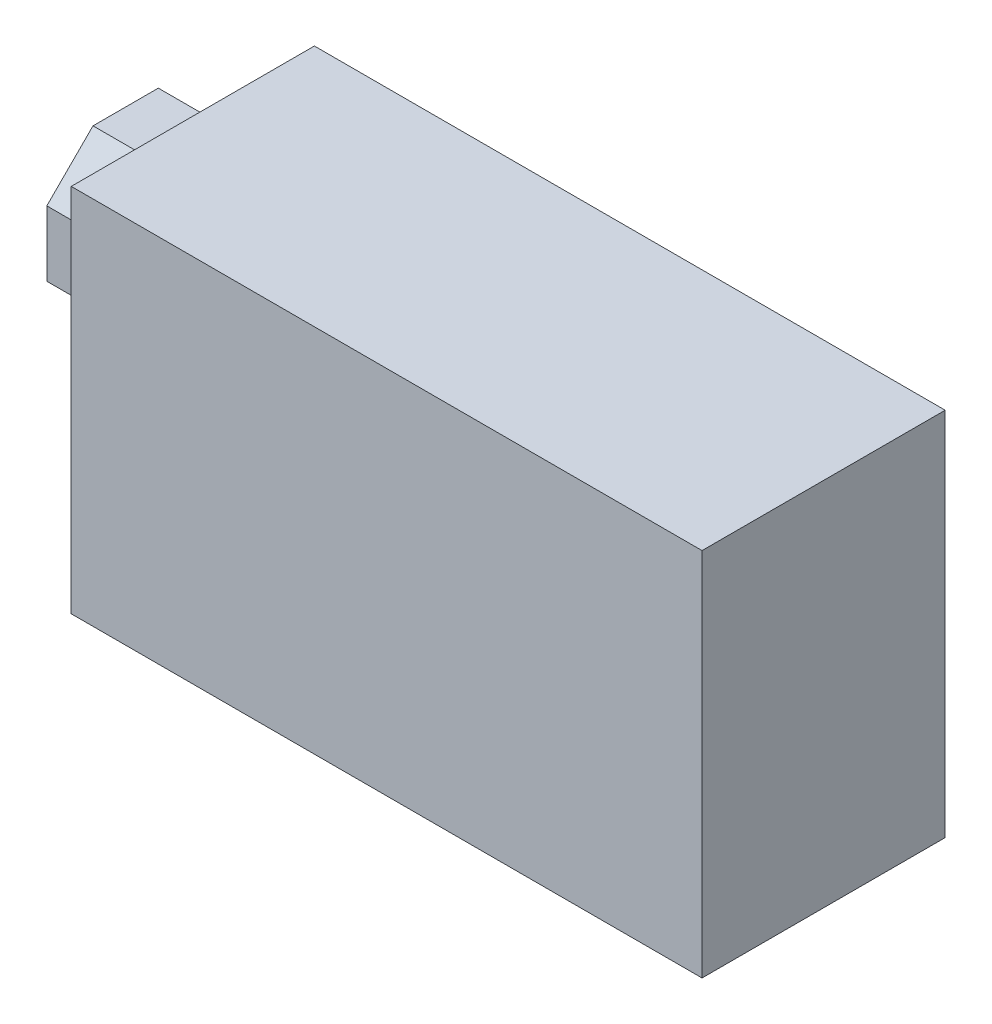
from build123d import *

# Parameters (mm, degrees)
SKETCH1_W           = 44.15
SKETCH1_H           = 25.908
BOSS_EXTRUDE1_DEPTH = 17.018
SKETCH2_R           = 3.556
BOSS_EXTRUDE2_DEPTH = 4.7
SKETCH3_R           = 2.438606829
CUT_EXTRUDE1_DEPTH  = 3.81


with BuildPart() as part:
    # Sketch1 → Boss-Extrude1 (new body)
    with BuildSketch(Plane.XY):
        with Locations((22.075, 12.954)):
            Rectangle(SKETCH1_W, SKETCH1_H)
    extrude(amount=BOSS_EXTRUDE1_DEPTH)

    # Sketch2 → Boss-Extrude2 (add)
    with BuildSketch(Plane.ZY):
        with Locations(Location((8.509, 6.602690832, 0), (0, 0, 180))):
            Circle(SKETCH2_R)
        Polygon((14.027892204, 20.883427677), (10.795, 24.116319881), (6.223, 24.116319881), (2.990107796, 20.883427677), (2.990107796, 16.311427677), (6.223, 13.078535474), (10.795, 13.078535474), (14.027892204, 16.311427677), align=None)
    extrude(amount=BOSS_EXTRUDE2_DEPTH)

    # Sketch3 → Cut-Extrude1 (cut)
    with BuildSketch(Plane.ZY.offset(4.7)):
        with Locations((8.509, 6.602690832)):
            Circle(SKETCH3_R)
        Polygon((12.568856448, 20.376314243), (10.129301757, 22.729112808), (6.740596271, 22.667766962), (4.387797706, 20.228212271), (4.449143552, 16.839506785), (6.888698243, 14.48670822), (10.277403729, 14.548054066), (12.630202294, 16.987608757), align=None)
    extrude(amount=-CUT_EXTRUDE1_DEPTH, mode=Mode.SUBTRACT)


solid = part.part
